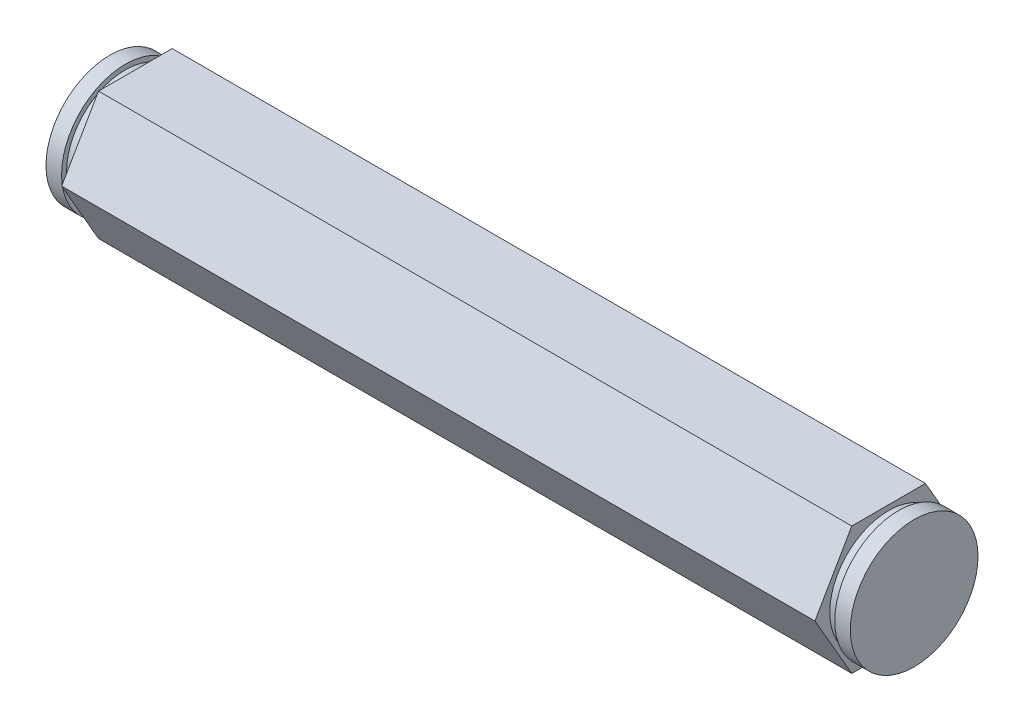
from build123d import *

# Parameters (mm, degrees)
BOSS_EXTRUDE1_DEPTH = 40.005


with BuildPart() as part:
    # Sketch1 → Boss-Extrude1 (new, symmetric)
    with BuildSketch(Plane(origin=(0, 0, 0), x_dir=(0, 0, -1), z_dir=(1, 0, 0))):
        Polygon((7.332348419, 0), (3.666174209, 6.35), (-3.666174209, 6.35), (-7.332348419, 0), (-3.666174209, -6.35), (3.666174209, -6.35), align=None)
    extrude(amount=BOSS_EXTRUDE1_DEPTH, both=True)

    # Sketch2 → Cut-Revolve1 (revolve, cut)
    with BuildSketch(Plane(origin=(0, 0, 0), x_dir=(1, 0, 0), z_dir=(0, 1, 0))):
        Polygon((37.465, -5.8547), (38.4556, -5.8547), (38.4556, -6.35), (40.005, -6.35), (40.005, -8.89), (37.465, -8.89), align=None)
    cut_revolve1 = revolve(axis=Axis((0, 0, 0), (1, 0, 0)), mode=Mode.SUBTRACT)

    # Mirror1: Cut-Revolve1 across plane
    add(cut_revolve1.mirror(Plane(origin=(0, 0, 0), x_dir=(0, 0, 1), z_dir=(1, 0, 0))), mode=Mode.SUBTRACT)


solid = part.part
